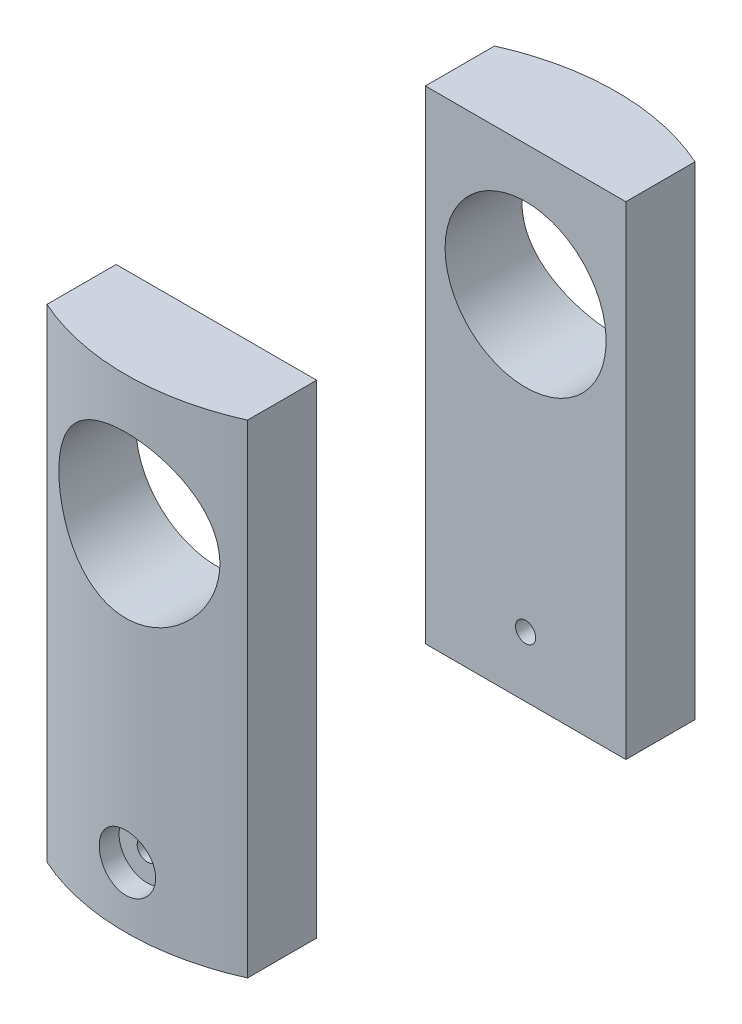
from build123d import *

# Parameters (mm, degrees)
BOSS_EXTRUDE1_DEPTH     = 152.4
BOSS_EXTRUDE1_2_DEPTH   = 152.4
CUT_EXTRUDE1_DEPTH      = 127
CUT_EXTRUDE1_DEPTH_BACK = 30.48
SKETCH4_R               = 3.175
CUT_EXTRUDE2_DEPTH      = 127
CUT_EXTRUDE2_DEPTH_BACK = 30.48
SKETCH5_R               = 25.4
SKETCH6_R               = 8.89
CUT_EXTRUDE3_DEPTH      = 10.16
CUT_EXTRUDE4_START      = 10.16
SKETCH7_R               = 8.89
CUT_EXTRUDE4_DEPTH      = 10.16


with BuildPart() as part:
    # Sketch3 → Boss-Extrude1 (new body)
    with BuildSketch(Plane(origin=(0, 0, 0), x_dir=(1, 0, 0), z_dir=(0, 1, 0))):
        with BuildLine():
            Line((-31.623, 48.768), (31.623, 48.768))
            Line((31.623, 48.768), (31.623, 70.582756534))
            ThreePointArc((31.623, 70.582756534), (0, 77.343), (-31.623, 70.582756534))
            Line((-31.623, 70.582756534), (-31.623, 48.768))
        make_face()
    extrude(amount=BOSS_EXTRUDE1_DEPTH)


with BuildPart() as body_2:
    # Sketch3 → Boss-Extrude1 2 (new body)
    with BuildSketch(Plane(origin=(0, 0, 0), x_dir=(1, 0, 0), z_dir=(0, 1, 0))):
        with BuildLine():
            Line((-31.623, -48.768), (31.623, -48.768))
            Line((31.623, -48.768), (31.623, -70.582756534))
            ThreePointArc((31.623, -70.582756534), (0, -77.343), (-31.623, -70.582756534))
            Line((-31.623, -70.582756534), (-31.623, -48.768))
        make_face()
    extrude(amount=BOSS_EXTRUDE1_2_DEPTH)


with BuildPart() as cut_extrude1_tool:
    # Sketch4 → Cut-Extrude1 (new, two sides: drawn at the far end of the back side and taken through both)
    with BuildSketch(Plane.XY.offset(-48.768).offset(-CUT_EXTRUDE1_DEPTH_BACK)):
        with Locations(Location((0, 19.05, 0), (0, 0, 180))):
            Circle(SKETCH4_R)
    extrude(amount=CUT_EXTRUDE1_DEPTH + CUT_EXTRUDE1_DEPTH_BACK)


with BuildPart() as part_1:
    add(part.part)

    # Cut-Extrude1: cut by cut_extrude1_tool
    add(cut_extrude1_tool.part, mode=Mode.SUBTRACT)


with BuildPart() as body_2_1:
    add(body_2.part)

    # Cut-Extrude1: cut by cut_extrude1_tool
    add(cut_extrude1_tool.part, mode=Mode.SUBTRACT)


with BuildPart() as cut_extrude2_tool:
    # Sketch5 → Cut-Extrude2 (new, two sides: drawn at the far end of the back side and taken through both)
    with BuildSketch(Plane.XY.offset(-48.768).offset(-CUT_EXTRUDE2_DEPTH_BACK)):
        with Locations(Location((0, 111.241035357, 0), (0, 0, 180))):
            Circle(SKETCH5_R)
    extrude(amount=CUT_EXTRUDE2_DEPTH + CUT_EXTRUDE2_DEPTH_BACK)


with BuildPart() as part_2:
    add(part_1.part)

    # Cut-Extrude2: cut by cut_extrude2_tool
    add(cut_extrude2_tool.part, mode=Mode.SUBTRACT)

    # Sketch6 → Cut-Extrude3 (cut)
    with BuildSketch(Plane(origin=(0, 0, -70.582756534), x_dir=(-1, 0, 0), z_dir=(0, 0, -1))):
        with Locations(Location((0, 19.05, 0), (0, 0, 180))):
            Circle(SKETCH6_R)
    extrude(amount=CUT_EXTRUDE3_DEPTH, mode=Mode.SUBTRACT)


with BuildPart() as body_2_2:
    add(body_2_1.part)

    # Cut-Extrude2: cut by cut_extrude2_tool
    add(cut_extrude2_tool.part, mode=Mode.SUBTRACT)

    # Sketch7 → Cut-Extrude4 (cut)
    with BuildSketch(Plane.XY.offset(70.582756534).offset(CUT_EXTRUDE4_START)):
        with Locations((0, 19.05)):
            Circle(SKETCH7_R)
    extrude(amount=-CUT_EXTRUDE4_DEPTH, mode=Mode.SUBTRACT)


solid = Compound([part_2.part, body_2_2.part])
